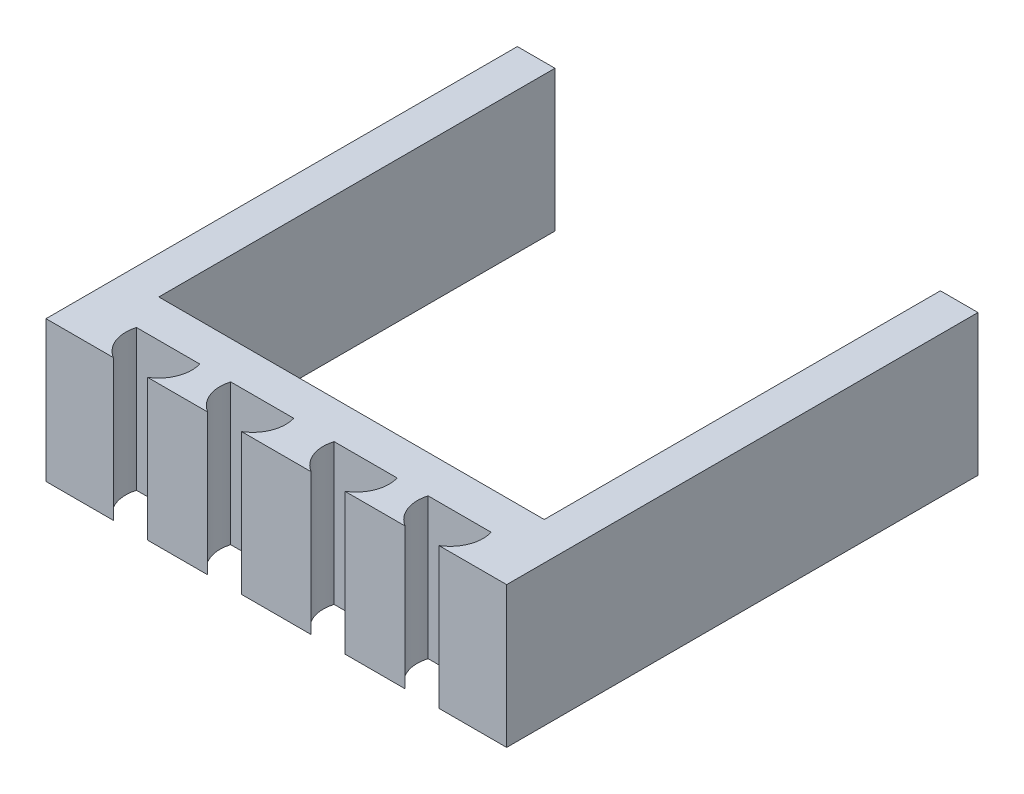
from build123d import *

# Parameters (mm, degrees)
EXTRUDE_1_DEPTH = 15
EXTRUDE_4_DEPTH = 15


with BuildPart() as part:
    # 草图1 → 凸台-拉伸1 (new body)
    with BuildSketch(Plane(origin=(0, 0, 0), x_dir=(1, 0, 0), z_dir=(0, 1, 0))):
        Polygon((-20.642691415, 18.026682135), (-20.642691415, -24.110208817), (20.357308585, -24.110208817), (20.357308585, 18.026682135), (24.357308585, 18.026682135), (24.357308585, -28.110208817), (-24.642691415, -28.110208817), (-24.642691415, 18.026682135), align=None)
    extrude(amount=EXTRUDE_1_DEPTH)

    # 草图3 → 凸台-拉伸4 (add)
    with BuildSketch(Plane.XZ):
        with BuildLine():
            Line((-24.642691415, 28.110208817), (-24.642691415, 32.110208817))
            Line((-24.642691415, 32.110208817), (-17.486324867, 32.110208817))
            ThreePointArc((-17.486324867, 32.110208817), (-18.930816259, 30.370057744), (-19.018929604, 28.110208817))
            Line((-19.018929604, 28.110208817), (-24.642691415, 28.110208817))
        make_face()
        with BuildLine():
            Line((-13.839915778, 32.110208817), (-7.445467053, 32.110208817))
            ThreePointArc((-7.445467053, 32.110208817), (-8.905871866, 30.375773254), (-8.996793382, 28.110208817))
            Line((-8.996793382, 28.110208817), (-12.288589449, 28.110208817))
            ThreePointArc((-12.288589449, 28.110208817), (-12.379510964, 30.375773254), (-13.839915778, 32.110208817))
        make_face()
        with BuildLine():
            Line((-3.839915778, 32.110208817), (3.554532947, 32.110208817))
            ThreePointArc((3.554532947, 32.110208817), (2.094128134, 30.375773254), (2.003206618, 28.110208817))
            Line((2.003206618, 28.110208817), (-2.288589449, 28.110208817))
            ThreePointArc((-2.288589449, 28.110208817), (-2.379510964, 30.375773254), (-3.839915778, 32.110208817))
        make_face()
        with BuildLine():
            Line((7.160084222, 32.110208817), (13.554532947, 32.110208817))
            ThreePointArc((13.554532947, 32.110208817), (12.094128134, 30.375773254), (12.003206618, 28.110208817))
            Line((12.003206618, 28.110208817), (8.70892166, 28.101898452))
            ThreePointArc((8.70892166, 28.101898452), (8.622054937, 30.371728239), (7.160084222, 32.110208817))
        make_face()
        with BuildLine():
            Line((17.160084222, 32.110208817), (24.357308585, 32.110208817))
            Line((24.357308585, 32.110208817), (24.357308585, 28.110208817))
            Line((24.357308585, 28.110208817), (18.711410551, 28.110208817))
            ThreePointArc((18.711410551, 28.110208817), (18.620489036, 30.375773254), (17.160084222, 32.110208817))
        make_face()
    extrude(amount=-EXTRUDE_4_DEPTH)


solid = part.part
